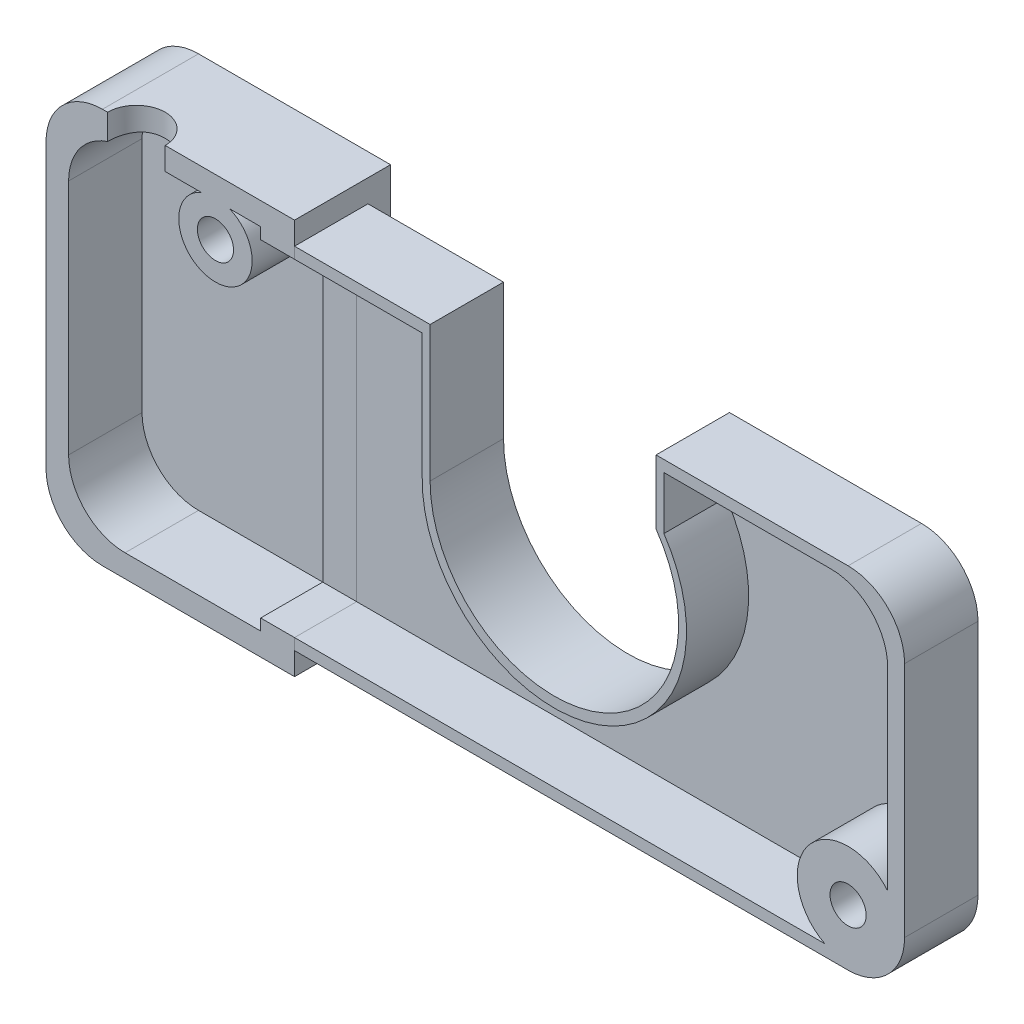
from build123d import *

# Parameters (mm, degrees)
BOSS_EXTRUDE1_DEPTH  = 17
CUT_EXTRUDE1_START   = -17
SKETCH3_W            = 12
SKETCH3_H            = 2
CUT_EXTRUDE1_DEPTH   = 17
CUT_EXTRUDE2_START   = -2
CUT_EXTRUDE2_DEPTH   = 2
SKETCH5_W            = 60
SKETCH5_H            = 35
CUT_EXTRUDE3_DEPTH   = 2
CUT_EXTRUDE4_DEPTH   = 11
CUT_EXTRUDE11_DEPTH  = 13
BOSS_EXTRUDE2_DEPTH  = 2
SKETCH13_R           = 2.5
CUT_EXTRUDE12_DEPTH  = 5
SKETCH14_R           = 2.55
CUT_EXTRUDE14_DEPTH  = 15
BOSS_EXTRUDE5_REACH  = 87.381
SKETCH15_R           = 3.25
SKETCH15_R_2         = 1.6
SKETCH15_4_R         = 3.25
SKETCH15_4_R_2       = 1.6
CUT_EXTRUDE16_DEPTH  = 1
SKETCH18_R           = 1.6
CUT_EXTRUDE17_DEPTH  = 15
SKETCH20_R           = 4.5
SKETCH20_R_2         = 1.6
BOSS_EXTRUDE6_DEPTH  = 13
SKETCH20_3_R         = 1.6
CUT_EXTRUDE20_DEPTH  = 86.005882191
SKETCH22_W           = 13
SKETCH22_H           = 31
SKETCH22_W_2         = 11
SKETCH22_H_2         = 29
BOSS_EXTRUDE7_DEPTH  = 3
SKETCH21_R           = 3.5
CUT_EXTRUDE21_DEPTH  = 2
SKETCH29_R           = 3.5
CUT_EXTRUDE22_DEPTH  = 2.5
BOSS_EXTRUDE10_DEPTH = 13
SKETCH24_W           = 80
SKETCH24_H           = 36
CUT_EXTRUDE23_DEPTH  = 10


with BuildPart() as part:
    # Sketch1 → Boss-Extrude1 (new body)
    with BuildSketch(Plane.XY):
        with BuildLine():
            ThreePointArc((0, 5), (1.464466094, 1.464466094), (5, 0))
            Line((5, 0), (73, 0))
            ThreePointArc((73, 0), (76.535533906, 1.464466094), (78, 5))
            Line((78, 5), (78, 30))
            ThreePointArc((78, 30), (76.535533906, 33.535533906), (73, 35))
            Line((73, 35), (54, 35))
            Line((54, 35), (54, 27.32455532))
            ThreePointArc((54, 27.32455532), (48.31662479, 10.511911518), (34, 21))
            Line((34, 21), (34, 35))
            Line((34, 35), (5, 35))
            ThreePointArc((5, 35), (1.464466094, 33.535533906), (0, 30))
            Line((0, 30), (0, 5))
        make_face()
    extrude(amount=BOSS_EXTRUDE1_DEPTH)

    # Sketch3 → Cut-Extrude1 (cut)
    with BuildSketch(Plane.XY.offset(17).offset(CUT_EXTRUDE1_START)):
        with Locations((28, 34)):
            Rectangle(SKETCH3_W, SKETCH3_H)
        with BuildLine():
            Line((54, 33), (71, 33))
            ThreePointArc((71, 33), (74.535533906, 31.535533906), (76, 28))
            Line((76, 28), (76, 7))
            ThreePointArc((76, 7), (74.535533906, 3.464466094), (71, 2))
            Line((71, 2), (22, 2))
            Line((22, 2), (22, 0))
            Line((22, 0), (73, 0))
            ThreePointArc((73, 0), (76.535533906, 1.464466094), (78, 5))
            Line((78, 5), (78, 30))
            ThreePointArc((78, 30), (76.535533906, 33.535533906), (73, 35))
            Line((73, 35), (54, 35))
            Line((54, 35), (54, 33))
        make_face()
    extrude(amount=CUT_EXTRUDE1_DEPTH, mode=Mode.SUBTRACT)

    # Sketch3<3> → Cut-Extrude2 (cut)
    with BuildSketch(Plane.XY.offset(17).offset(CUT_EXTRUDE2_START)):
        with BuildLine():
            ThreePointArc((76, 28), (74.535533906, 31.535533906), (71, 33))
            Line((71, 33), (54, 33))
            Line((54, 33), (54, 27.32455532))
            ThreePointArc((54, 27.32455532), (48.31662479, 10.511911518), (34, 21))
            Line((34, 21), (34, 33))
            Line((34, 33), (22, 33))
            Line((22, 33), (22, 2))
            Line((22, 2), (71, 2))
            ThreePointArc((71, 2), (74.535533906, 3.464466094), (76, 7))
            Line((76, 7), (76, 28))
        make_face()
    extrude(amount=CUT_EXTRUDE2_DEPTH, mode=Mode.SUBTRACT)

    # Sketch5 → Cut-Extrude3 (cut)
    with BuildSketch(Plane(origin=(0, 0, 0), x_dir=(-1, 0, 0), z_dir=(0, 0, -1))):
        with Locations((-52, 15.5)):
            Rectangle(SKETCH5_W, SKETCH5_H)
    extrude(amount=-CUT_EXTRUDE3_DEPTH, mode=Mode.SUBTRACT)

    # Sketch6 → Cut-Extrude4 (cut)
    with BuildSketch(Plane.XY.offset(14)):
        with BuildLine():
            Line((22, 32), (69.5, 32))
            ThreePointArc((69.5, 32), (73.035533906, 30.535533906), (74.5, 27))
            Line((74.5, 27), (74.5, 8))
            ThreePointArc((74.5, 8), (73.035533906, 4.464466094), (69.5, 3))
            Line((69.5, 3), (22, 3))
            Line((22, 3), (22, 32))
        make_face()
    extrude(amount=-CUT_EXTRUDE4_DEPTH, mode=Mode.SUBTRACT)

    # Sketch11 → Cut-Extrude11 (cut)
    with BuildSketch(Plane.XY.offset(15)):
        with BuildLine():
            Line((22, 2), (7, 2))
            ThreePointArc((7, 2), (3.464466094, 3.464466094), (2, 7))
            Line((2, 7), (2, 28))
            ThreePointArc((2, 28), (3.464466094, 31.535533906), (7, 33))
            Line((7, 33), (22, 33))
            Line((22, 33), (22, 2))
        make_face()
    extrude(amount=-CUT_EXTRUDE11_DEPTH, mode=Mode.SUBTRACT)


with BuildPart() as cut_extrude11_piece_1:
    # of the separate pieces the step leaves, piece 1, a body of its own (cut_extrude11_pieces)
    add(part.part.solids().sort_by_distance((0, 30, 0))[0])

    # Sketch13 → Cut-Extrude12 (cut)
    with BuildSketch(Plane.XY.offset(17)):
        with Locations((5, 7)):
            Circle(SKETCH13_R)
    extrude(amount=-CUT_EXTRUDE12_DEPTH, mode=Mode.SUBTRACT)

    # Sketch14 → Cut-Extrude14 (cut)
    with BuildSketch(Plane(origin=(0, 35, 0), x_dir=(1, 0, 0), z_dir=(0, 1, 0))):
        with Locations(Location((8, -8.5, 0), (0, 0, 270))):
            Circle(SKETCH14_R)
    extrude(amount=-CUT_EXTRUDE14_DEPTH, mode=Mode.SUBTRACT)

    # Sketch15 → Boss-Extrude5 (add, up to next)
    with BuildSketch(Plane.XY.offset(17), mode=Mode.PRIVATE) as boss_extrude5_sk1:
        with Locations((15, 30)):
            Circle(SKETCH15_R)
        with Locations((15, 30)):
            Circle(SKETCH15_R_2, mode=Mode.SUBTRACT)
    boss_extrude5_tool1 = extrude(boss_extrude5_sk1.sketch, amount=-BOSS_EXTRUDE5_REACH, mode=Mode.PRIVATE) - cut_extrude11_piece_1.part
    add(boss_extrude5_tool1.solids().sort_by_distance((11.841924, 30, 17))[0])

    # Sketch15<4> → Cut-Extrude16 (cut)
    with BuildSketch(Plane.XY.offset(17)):
        with Locations((15, 30)):
            Circle(SKETCH15_4_R)
        with Locations((15, 30)):
            Circle(SKETCH15_4_R_2, mode=Mode.SUBTRACT)
    extrude(amount=-CUT_EXTRUDE16_DEPTH, mode=Mode.SUBTRACT)

    # Sketch18 → Cut-Extrude17 (cut)
    with BuildSketch(Plane.XY.offset(17)):
        with Locations((15, 30)):
            Circle(SKETCH18_R)
    extrude(amount=-CUT_EXTRUDE17_DEPTH, mode=Mode.SUBTRACT)

    # Sketch22 → Boss-Extrude7 (add)
    with BuildSketch(Plane(origin=(22, 0, 0), x_dir=(0, 0, -1), z_dir=(1, 0, 0))):
        with Locations((-8.5, 17.5)):
            Rectangle(SKETCH22_W, SKETCH22_H)
        with Locations((-8.5, 17.5)):
            Rectangle(SKETCH22_W_2, SKETCH22_H_2, mode=Mode.SUBTRACT)
    extrude(amount=-BOSS_EXTRUDE7_DEPTH)


with BuildPart() as cut_extrude11_piece_2:
    # of the separate pieces the step leaves, piece 2, a body of its own (cut_extrude11_pieces)
    add(part.part.solids().sort_by_distance((34, 33, 2))[0])

    # Sketch12 → Boss-Extrude2 (add)
    with BuildSketch(Plane.XY.offset(15)):
        with BuildLine():
            Line((39.5, 5.75), (40.7, 5.75))
            ThreePointArc((40.7, 5.75), (41.053553391, 5.603553391), (41.2, 5.25))
            Line((41.2, 5.25), (41.2, 4.75))
            ThreePointArc((41.2, 4.75), (41.053553391, 4.396446609), (40.7, 4.25))
            Line((40.7, 4.25), (39.5, 4.25))
            ThreePointArc((39.5, 4.25), (39.146446609, 4.396446609), (39, 4.75))
            Line((39, 4.75), (39, 5.25))
            ThreePointArc((39, 5.25), (39.146446609, 5.603553391), (39.5, 5.75))
        make_face()
    extrude(amount=BOSS_EXTRUDE2_DEPTH)

    # Sketch20 → Boss-Extrude6 (add)
    with BuildSketch(Plane.XY.offset(15)):
        with Locations((71, 7)):
            Circle(SKETCH20_R)
        with Locations((71, 7)):
            Circle(SKETCH20_R_2, mode=Mode.SUBTRACT)
    extrude(amount=-BOSS_EXTRUDE6_DEPTH)

    # Sketch20<3> → Cut-Extrude20 (cut, through all)
    with BuildSketch(Plane.XY.offset(15)):
        with Locations((71, 7)):
            Circle(SKETCH20_3_R)
    extrude(amount=-CUT_EXTRUDE20_DEPTH, mode=Mode.SUBTRACT)

    # Sketch21 → Cut-Extrude21 (cut)
    with BuildSketch(Plane(origin=(0, 0, 2), x_dir=(-1, 0, 0), z_dir=(0, 0, -1))):
        with Locations((-71, 7)):
            Circle(SKETCH21_R)
    extrude(amount=-CUT_EXTRUDE21_DEPTH, mode=Mode.SUBTRACT)

    # Sketch29 → Cut-Extrude22 (cut)
    with BuildSketch(Plane.XY.offset(15)):
        with Locations(Location((71, 7, 0), (0, 0, 180))):
            Circle(SKETCH29_R)
    extrude(amount=-CUT_EXTRUDE22_DEPTH, mode=Mode.SUBTRACT)

    # Sketch36 → Boss-Extrude10 (add)
    with BuildSketch(Plane.XY.offset(15)):
        with BuildLine():
            Line((34, 21), (34, 33))
            Line((34, 33), (33.3, 33))
            Line((33.3, 33), (33.3, 21))
            ThreePointArc((33.3, 21), (48.314061384, 9.565059525), (54.7, 27.32455532))
            Line((54.7, 27.32455532), (54.7, 33))
            Line((54.7, 33), (54, 33))
            Line((54, 33), (54, 27.32455532))
            ThreePointArc((54, 27.32455532), (48.31662479, 10.511911518), (34, 21))
        make_face()
    extrude(amount=-BOSS_EXTRUDE10_DEPTH)


with BuildPart() as cut_extrude23_tool:
    # Sketch24 → Cut-Extrude23 (new body)
    with BuildSketch(Plane.XY.offset(8.5)):
        with Locations((40, 18)):
            Rectangle(SKETCH24_W, SKETCH24_H)
    extrude(amount=CUT_EXTRUDE23_DEPTH)


with BuildPart() as cut_extrude11_piece_1_1:
    add(cut_extrude11_piece_1.part)

    # Cut-Extrude23: cut by cut_extrude23_tool
    add(cut_extrude23_tool.part, mode=Mode.SUBTRACT)


with BuildPart() as cut_extrude11_piece_2_1:
    add(cut_extrude11_piece_2.part)

    # Cut-Extrude23: cut by cut_extrude23_tool
    add(cut_extrude23_tool.part, mode=Mode.SUBTRACT)


solid = Compound([cut_extrude11_piece_1_1.part, cut_extrude11_piece_2_1.part])
